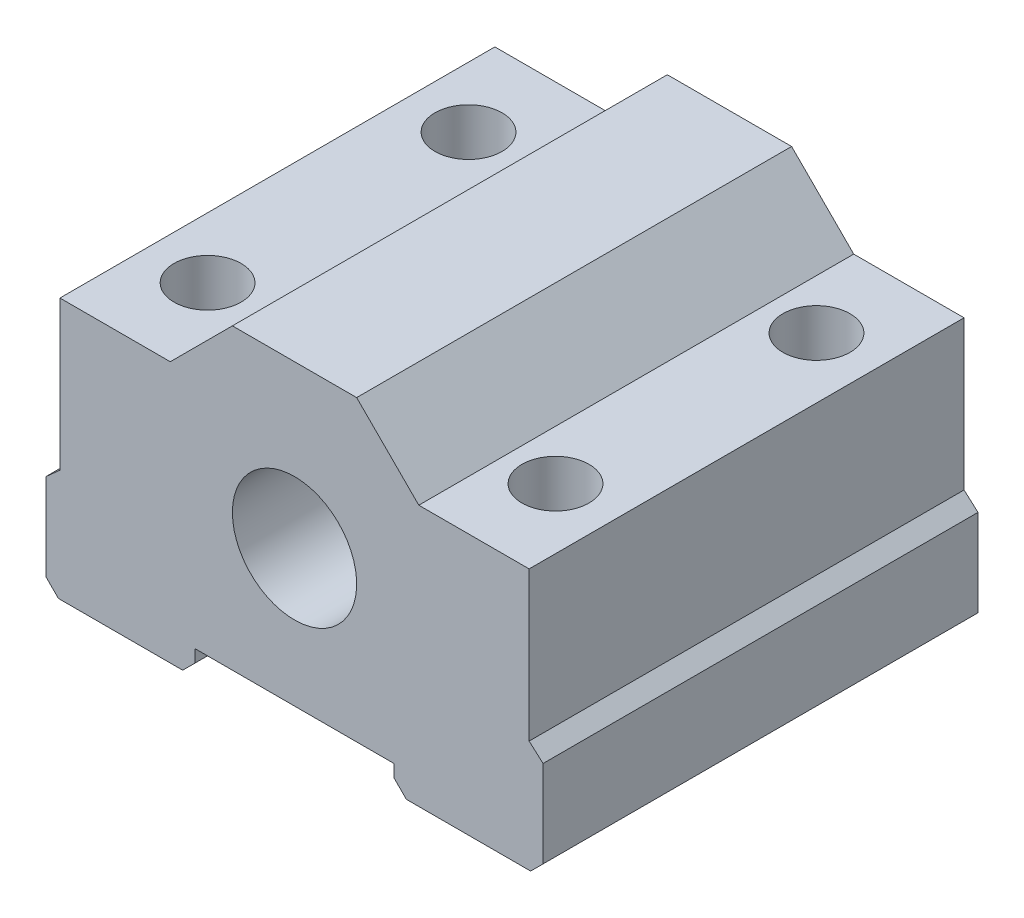
from build123d import *

# Parameters (mm, degrees)
SKETCH_1_W          = 40
SKETCH_1_H          = 26
EXTRUDE_1_DEPTH     = 35
CUT_EXTRUDE_1_DEPTH = 43.355637169
SKETCH_4_R          = 2.5
CUT_EXTRUDE_2_DEPTH = 46.453272709
CUT_EXTRUDE_3_DEPTH = 43.355637169
SKETCH_7_W          = 8
SKETCH_7_H          = 2
CUT_EXTRUDE_4_DEPTH = 43.355637169
CHAMFER_1_SIZE      = 1
EXTRUDE_START       = -21
SKETCH_9_R          = 2.5
EXTRUDE_2_DEPTH     = 21
SKETCH_10_R         = 2.7
CUT_EXTRUDE_5_DEPTH = 48.968739821
SKETCH_13_R         = 2.5
EXTRUDE_3_DEPTH     = 21
SKETCH_14_R         = 2.7
CUT_EXTRUDE_6_DEPTH = 48.968739821
SKETCH_15_R         = 2.7
CUT_EXTRUDE_7_DEPTH = 48.968739821


with BuildPart() as part:
    # Эскиз1 → Бобышка-Вытянуть1 (new body)
    with BuildSketch(Plane.XY):
        Rectangle(SKETCH_1_W, SKETCH_1_H)
    extrude(amount=EXTRUDE_1_DEPTH)

    # Эскиз2 → Вырез-Вытянуть1 (cut, through all)
    with BuildSketch(Plane(origin=(0, 0, 0), x_dir=(-1, 0, 0), z_dir=(0, 0, -1))):
        Polygon((-10, 8), (-5, 13), (-20, 13), (-20, 8), align=None)
        Polygon((20, 13), (5, 13), (10, 8), (20, 8), align=None)
        with BuildLine():
            ThreePointArc((5, 0), (3.535533906, 3.535533906), (0, 5))
            Line((0, 5), (0, 0))
            Line((0, 0), (0, -5))
            ThreePointArc((0, -5), (3.535533906, -3.535533906), (5, 0))
        make_face()
        with BuildLine():
            Line((0, 0), (0, 5))
            ThreePointArc((0, 5), (-5, 0), (0, -5))
            Line((0, -5), (0, 0))
        make_face()
    extrude(amount=-CUT_EXTRUDE_1_DEPTH, mode=Mode.SUBTRACT)

    # Эскиз4 → Вырез-Вытянуть2 (cut, through all)
    with BuildSketch(Plane(origin=(0, 8, 0), x_dir=(1, 0, 0), z_dir=(0, 1, 0))):
        with BuildLine():
            ThreePointArc((-12.5, -7), (-15, -4.5), (-17.5, -7))
            Line((-17.5, -7), (-12.5, -7))
        make_face()
        with BuildLine():
            Line((-12.5, -7), (-17.5, -7))
            ThreePointArc((-17.5, -7), (-15, -9.5), (-12.5, -7))
        make_face()
        with BuildLine():
            ThreePointArc((-12.5, -28), (-15, -25.5), (-17.5, -28))
            Line((-17.5, -28), (-12.5, -28))
        make_face()
        with BuildLine():
            Line((-12.5, -28), (-17.5, -28))
            ThreePointArc((-17.5, -28), (-15, -30.5), (-12.5, -28))
        make_face()
        with Locations(Location((15, -28, 0), (0, 0, 180))):
            Circle(SKETCH_4_R)
        with Locations(Location((15, -7, 0), (0, 0, 180))):
            Circle(SKETCH_4_R)
    extrude(amount=-CUT_EXTRUDE_2_DEPTH, mode=Mode.SUBTRACT)

    # Эскиз6 → Вырез-Вытянуть3 (cut, through all)
    with BuildSketch(Plane.XY.offset(35)):
        Polygon((-18.878222765, 8), (-20, 8), (-20, -5), (-18.878222765, -4), align=None)
        Polygon((18.878222765, 8), (18.878222765, -4), (20, -5), (20, 8), align=None)
    extrude(amount=-CUT_EXTRUDE_3_DEPTH, mode=Mode.SUBTRACT)

    # Эскиз7 → Вырез-Вытянуть4 (cut, through all)
    with BuildSketch(Plane.XY.offset(35)):
        with Locations((-4, -12)):
            Rectangle(SKETCH_7_W, SKETCH_7_H)
        with Locations((4, -12)):
            Rectangle(SKETCH_7_W, SKETCH_7_H)
    extrude(amount=-CUT_EXTRUDE_4_DEPTH, mode=Mode.SUBTRACT)

    # Фаска1
    chamfer_1_edges = [part.edges().sort_by_distance(p)[0] for p in [
        (20, -13, 17.5),
        (-20, -13, 17.5),
        (8, -13, 17.5),
        (-8, -13, 17.5),
    ]]
    chamfer(chamfer_1_edges, length=CHAMFER_1_SIZE)

    # Эскиз9 → Бобышка-Вытянуть2 (add)
    with BuildSketch(Plane.XZ.offset(13).offset(EXTRUDE_START)):
        with Locations((-15, 28)):
            Circle(SKETCH_9_R)
    extrude(amount=EXTRUDE_2_DEPTH)

    # Эскиз10 → Вырез-Вытянуть5 (cut, through all)
    with BuildSketch(Plane.XZ.offset(13)):
        with Locations(Location((-14, 28, 0), (0, 0, 270))):
            Circle(SKETCH_10_R)
    extrude(amount=-CUT_EXTRUDE_5_DEPTH, mode=Mode.SUBTRACT)

    # Эскиз13 → Бобышка-Вытянуть3 (add)
    with BuildSketch(Plane.XZ.offset(13).offset(EXTRUDE_START)):
        with Locations((-15, 7)):
            Circle(SKETCH_13_R)
        with Locations((15, 7)):
            Circle(SKETCH_13_R)
        with Locations((15, 28)):
            Circle(SKETCH_13_R)
    extrude(amount=EXTRUDE_3_DEPTH)

    # Эскиз14 → Вырез-Вытянуть6 (cut, through all)
    with BuildSketch(Plane.XZ.offset(13)):
        with Locations(Location((14, 28, 0), (0, 0, 270))):
            Circle(SKETCH_14_R)
    extrude(amount=-CUT_EXTRUDE_6_DEPTH, mode=Mode.SUBTRACT)

    # Эскиз15 → Вырез-Вытянуть7 (cut, through all)
    with BuildSketch(Plane.XZ.offset(13)):
        with Locations(Location((-14, 7, 0), (0, 0, 270))):
            Circle(SKETCH_15_R)
        with Locations(Location((14, 7, 0), (0, 0, 270))):
            Circle(SKETCH_15_R)
    extrude(amount=-CUT_EXTRUDE_7_DEPTH, mode=Mode.SUBTRACT)


solid = part.part
